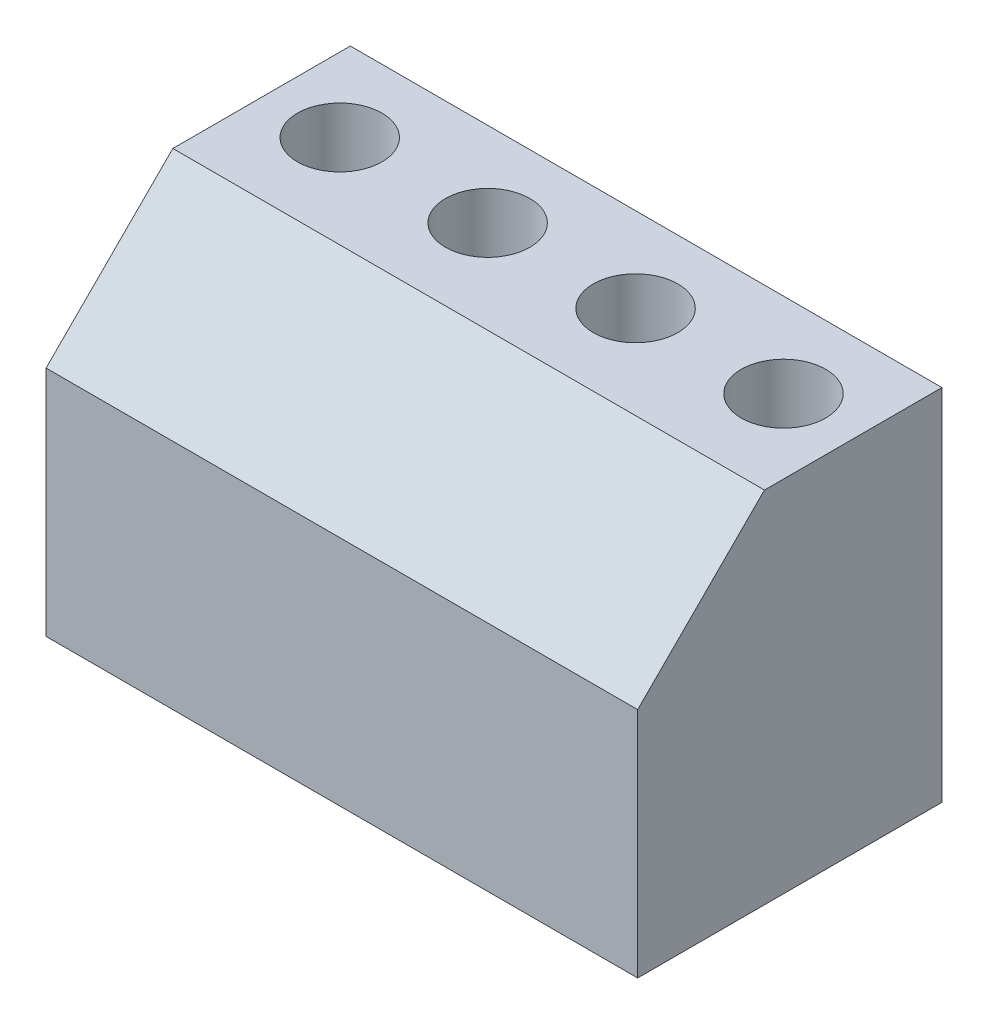
from build123d import *

# Parameters (mm, degrees)
SKETCH_1_W          = 14
SKETCH_1_H          = 7.2
EXTRUDE_1_DEPTH     = 8.5
CHAMFER_1_SIZE      = 3
SKETCH_2_R          = 1
CUT_EXTRUDE_1_DEPTH = 4


with BuildPart() as part:
    # Эскиз1 → Бобышка-Вытянуть1 (new body)
    with BuildSketch(Plane(origin=(0, 0, 0), x_dir=(1, 0, 0), z_dir=(0, 1, 0))):
        with Locations((7, 3.6)):
            Rectangle(SKETCH_1_W, SKETCH_1_H)
    extrude(amount=EXTRUDE_1_DEPTH)

    # Фаска1
    chamfer_1_edges = [part.edges().sort_by_distance(p)[0] for p in [
        (7, 8.5, 0),
    ]]
    chamfer(chamfer_1_edges, length=CHAMFER_1_SIZE)

    # Эскиз2 → Вырез-Вытянуть1 (cut)
    with BuildSketch(Plane(origin=(0, 8.5, 0), x_dir=(1, 0, 0), z_dir=(0, 1, 0))):
        with Locations(Location((1.75, 5.2, 0), (0, 0, 270))):
            Circle(SKETCH_2_R)
        with Locations(Location((5.25, 5.2, 0), (0, 0, 270))):
            Circle(SKETCH_2_R)
        with Locations(Location((8.75, 5.2, 0), (0, 0, 270))):
            Circle(SKETCH_2_R)
        with Locations(Location((12.25, 5.2, 0), (0, 0, 270))):
            Circle(SKETCH_2_R)
    extrude(amount=-CUT_EXTRUDE_1_DEPTH, mode=Mode.SUBTRACT)


solid = part.part
